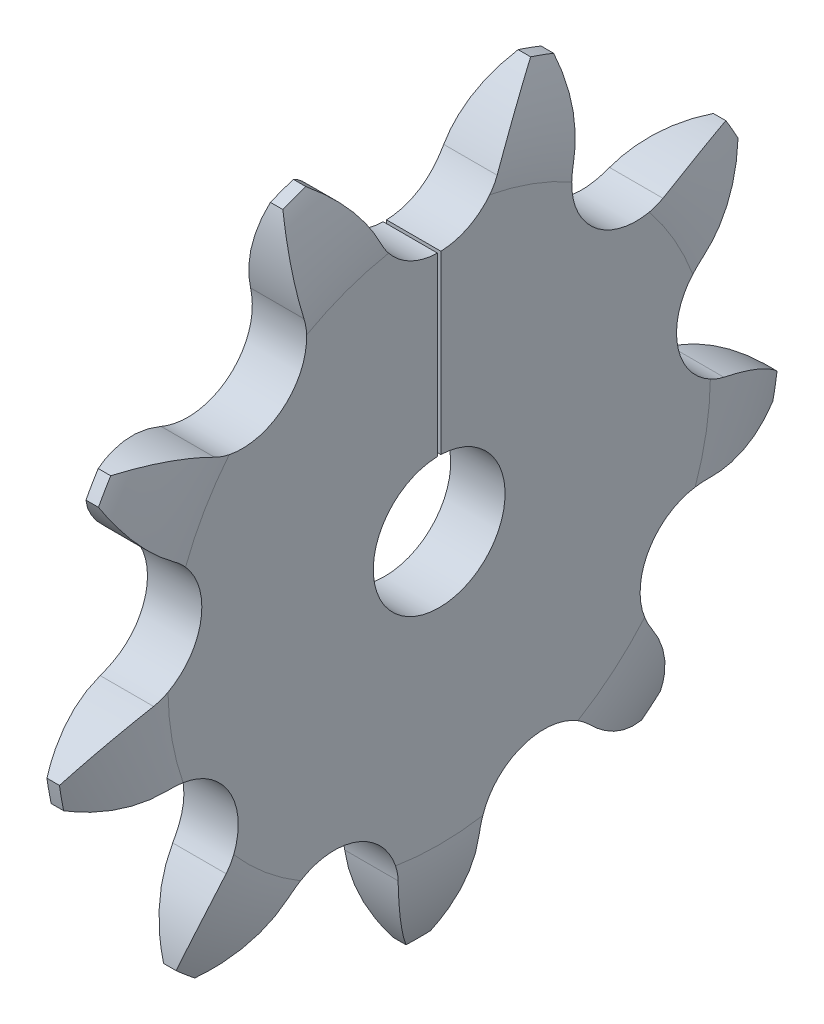
from build123d import *

# Parameters (mm, degrees)
CORTE_EXTRUS_O1_DEPTH = 32.287217837
PADR_OCIRCULAR2_COUNT = 9
ESBO_O6_R             = 4
CORTE_EXTRUS_O2_DEPTH = 32.134624111
ESBO_O7_W             = 0.2
ESBO_O7_H             = 30
CORTE_EXTRUS_O3_DEPTH = 10


with BuildPart() as part:
    # Esboço2 → Revolução1 (revolve)
    with BuildSketch(Plane.XY, mode=Mode.PRIVATE) as revolu_o1_sk:
        with BuildLine():
            Line((0, 0), (0, 16.464198342))
            ThreePointArc((0, 16.464198342), (0.321571182, 19.304004673), (1.27, 22))
            Line((1.27, 22), (2.03, 22))
            ThreePointArc((2.03, 22), (2.978428818, 19.304004673), (3.3, 16.464198342))
            Line((3.3, 16.464198342), (3.3, 0))
            Line((3.3, 0), (0, 0))
        make_face()
    revolve(revolu_o1_sk.sketch.rotate(Axis((0, 0, 0), (1, 0, 0)), 90), axis=Axis((0, 0, 0), (1, 0, 0)))

    # Esboço5 → Corte-extrusão1 (cut, through all)
    with BuildSketch(Plane(origin=(0, 0, 0), x_dir=(0, 0, -1), z_dir=(1, 0, 0))):
        with BuildLine():
            ThreePointArc((3.547062102, 16.950885739), (5.413227359, 19.685368366), (8.05493296, 21.680702805))
            ThreePointArc((8.05493296, 21.680702805), (0, 23.128657961), (-8.05493296, 21.680702805))
            ThreePointArc((-8.05493296, 21.680702805), (-5.413227359, 19.685368366), (-3.547062102, 16.950885739))
            ThreePointArc((-3.547062102, 16.950885739), (0, 14.691157961), (3.547062102, 16.950885739))
        make_face()
    corte_extrus_o1 = extrude(amount=CORTE_EXTRUS_O1_DEPTH, mode=Mode.SUBTRACT)

    # PadrãoCircular2: Corte-extrusão1 ×9 about axis
    padr_ocircular2_axis = Axis((0, 0, 0), (1, 0, 0))
    for i in range(1, PADR_OCIRCULAR2_COUNT):
        add(corte_extrus_o1.rotate(padr_ocircular2_axis, i * 360 / PADR_OCIRCULAR2_COUNT), mode=Mode.SUBTRACT)

    # Esboço6 → Corte-extrusão2 (cut, through all)
    with BuildSketch(Plane(origin=(3.3, 0, 0), x_dir=(0, 0, -1), z_dir=(1, 0, 0))):
        Circle(ESBO_O6_R)
    extrude(amount=-CORTE_EXTRUS_O2_DEPTH, mode=Mode.SUBTRACT)

    # Esboço7 → Corte-extrusão3 (cut)
    with BuildSketch(Plane(origin=(3.3, 0, 0), x_dir=(0, 0, -1), z_dir=(1, 0, 0))):
        with Locations((0, 15)):
            Rectangle(ESBO_O7_W, ESBO_O7_H)
    extrude(amount=-CORTE_EXTRUS_O3_DEPTH, mode=Mode.SUBTRACT)


solid = part.part
